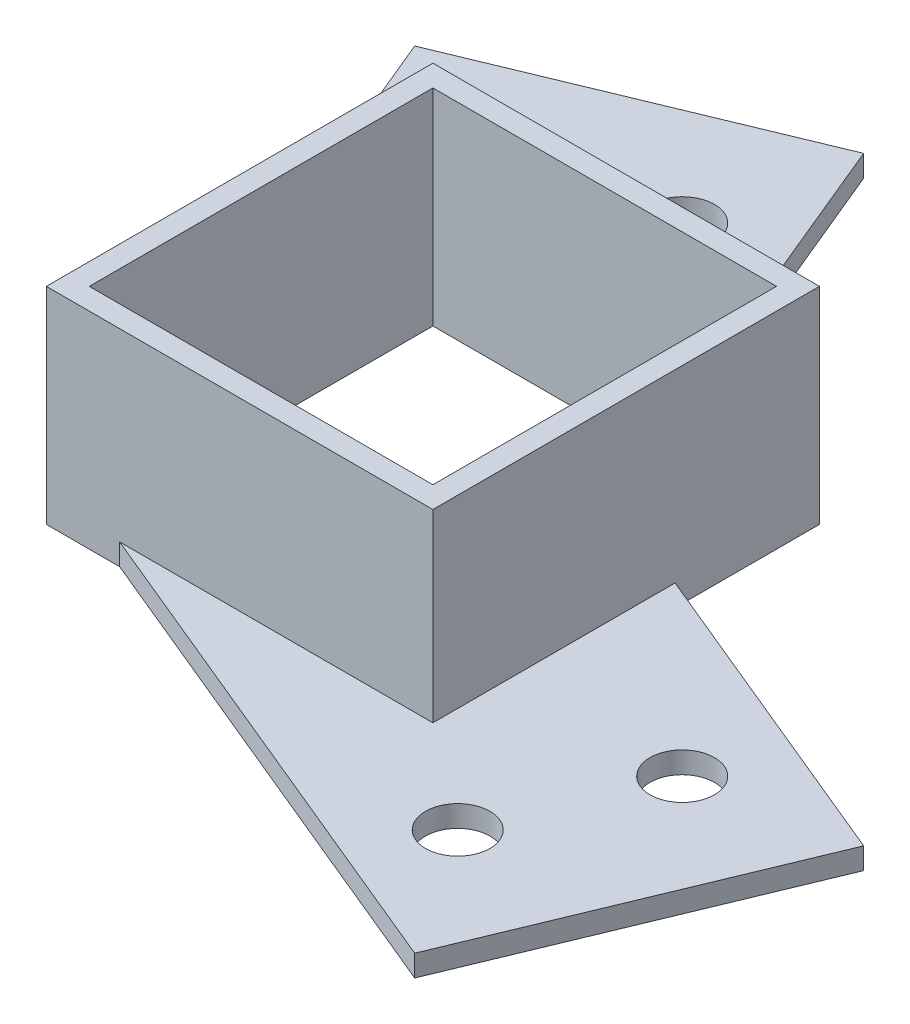
from build123d import *

# Parameters (mm, degrees)
SKETCH2_W           = 28.575
SKETCH2_H           = 28.575
SKETCH2_W_2         = 25.4
SKETCH2_H_2         = 25.4
BOSS_EXTRUDE1_DEPTH = 15.24
SKETCH2_3_R         = 2.38125
BOSS_EXTRUDE2_DEPTH = 1.5875


with BuildPart() as part:
    # Sketch2 → Boss-Extrude1 (new body)
    with BuildSketch(Plane(origin=(0, 0, 0), x_dir=(1, 0, 0), z_dir=(0, 1, 0))):
        Rectangle(SKETCH2_W, SKETCH2_H)
        Rectangle(SKETCH2_W_2, SKETCH2_H_2, mode=Mode.SUBTRACT)
    extrude(amount=BOSS_EXTRUDE1_DEPTH)

    # Sketch2<3> → Boss-Extrude2 (add)
    # profile 1 of 2: a face of its own
    with BuildSketch(Plane(origin=(0, 0, 0), x_dir=(1, 0, 0), z_dir=(0, 1, 0))):
        Polygon((-14.2875, 14.2875), (3.614173373, 14.2875), (-6.243738443, 38.086604402), (-29.710278569, 28.36644522), (-14.2875, -8.86743597), align=None)
        with Locations((-8.492237251, 26.921611065)):
            Circle(SKETCH2_3_R, mode=Mode.SUBTRACT)
        with Locations((-20.225507313, 22.061531474)):
            Circle(SKETCH2_3_R, mode=Mode.SUBTRACT)
    # profile 2 of 2: a face of its own
    with BuildSketch(Plane(origin=(0, 0, 0), x_dir=(1, 0, 0), z_dir=(0, 1, 0))):
        Polygon((14.2875, 3.614173373), (14.2875, -14.2875), (-8.86743597, -14.2875), (28.36644522, -29.710278569), (38.086604402, -6.243738443), align=None)
        with Locations((22.061531474, -20.225507313)):
            Circle(SKETCH2_3_R, mode=Mode.SUBTRACT)
        with Locations((26.921611065, -8.492237251)):
            Circle(SKETCH2_3_R, mode=Mode.SUBTRACT)
    extrude(amount=BOSS_EXTRUDE2_DEPTH)


solid = part.part
